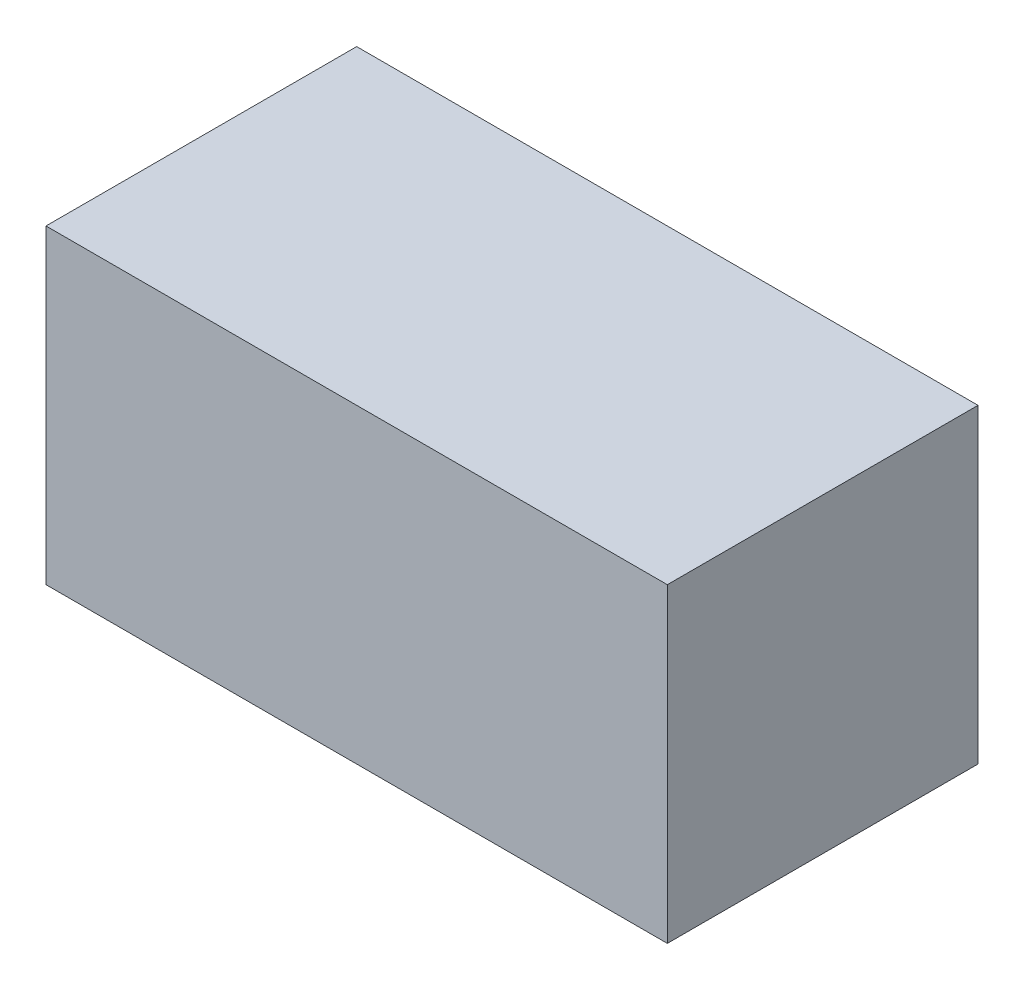
from build123d import *

# Parameters (mm, degrees)
ESQUISSE1_W      = 100
ESQUISSE1_H      = 50
EXTRUSION1_DEPTH = 50


with BuildPart() as part:
    # Esquisse1 → Extrusion1 (new body)
    with BuildSketch(Plane.XY):
        with Locations((-7.228017599, 1.214124191)):
            Rectangle(ESQUISSE1_W, ESQUISSE1_H)
    extrude(amount=EXTRUSION1_DEPTH)


solid = part.part
